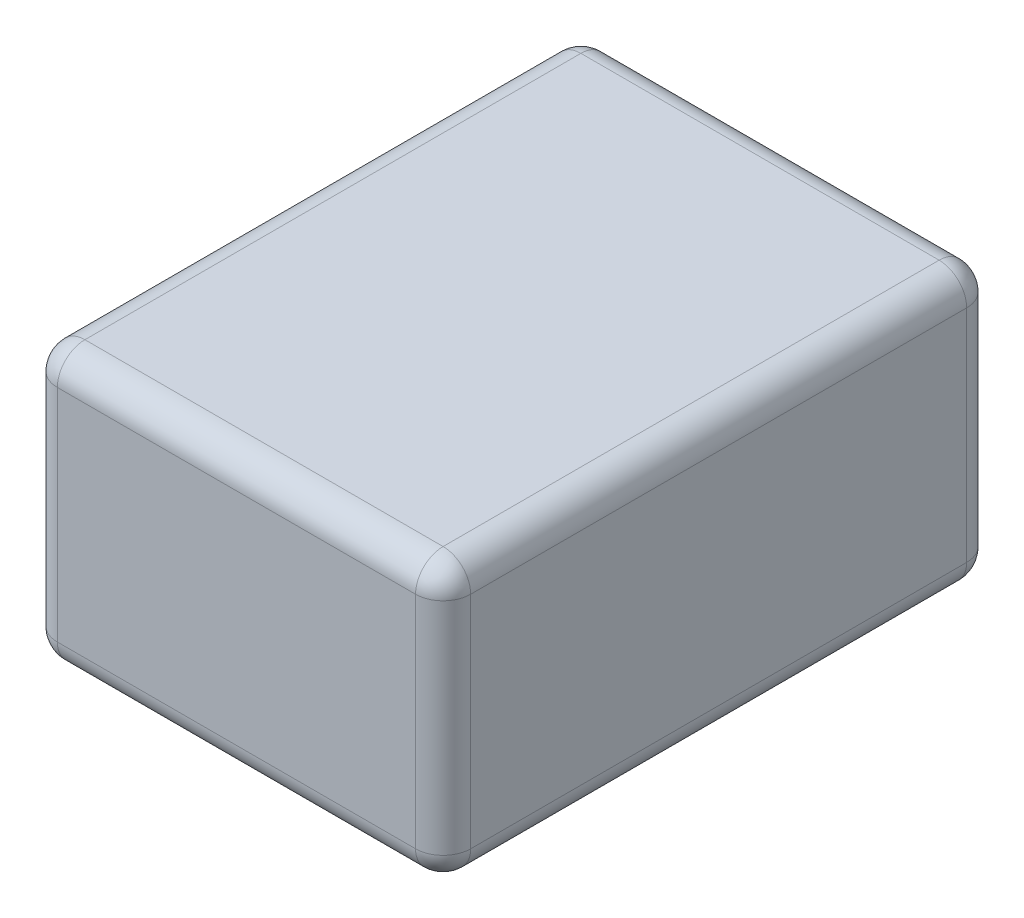
from build123d import *

# Parameters (mm, degrees)
SKETCH1_W           = 30
SKETCH1_H           = 20
BOSS_EXTRUDE1_DEPTH = 40
FILLET1_R           = 2


with BuildPart() as part:
    # Sketch1 → Boss-Extrude1 (new body)
    with BuildSketch(Plane.XY):
        Rectangle(SKETCH1_W, SKETCH1_H)
    extrude(amount=BOSS_EXTRUDE1_DEPTH)

    # Fillet1
    fillet1_edges = [part.edges().sort_by_distance(p)[0] for p in [
        (-15, 0, 40),
        (0, -10, 40),
        (15, 0, 40),
        (0, -10, 0),
        (-15, 0, 0),
        (0, 10, 0),
        (15, 0, 0),
        (15, -10, 20),
        (-15, -10, 20),
        (-15, 10, 20),
        (15, 10, 20),
        (0, 10, 40),
    ]]
    fillet(fillet1_edges, radius=FILLET1_R)


solid = part.part
